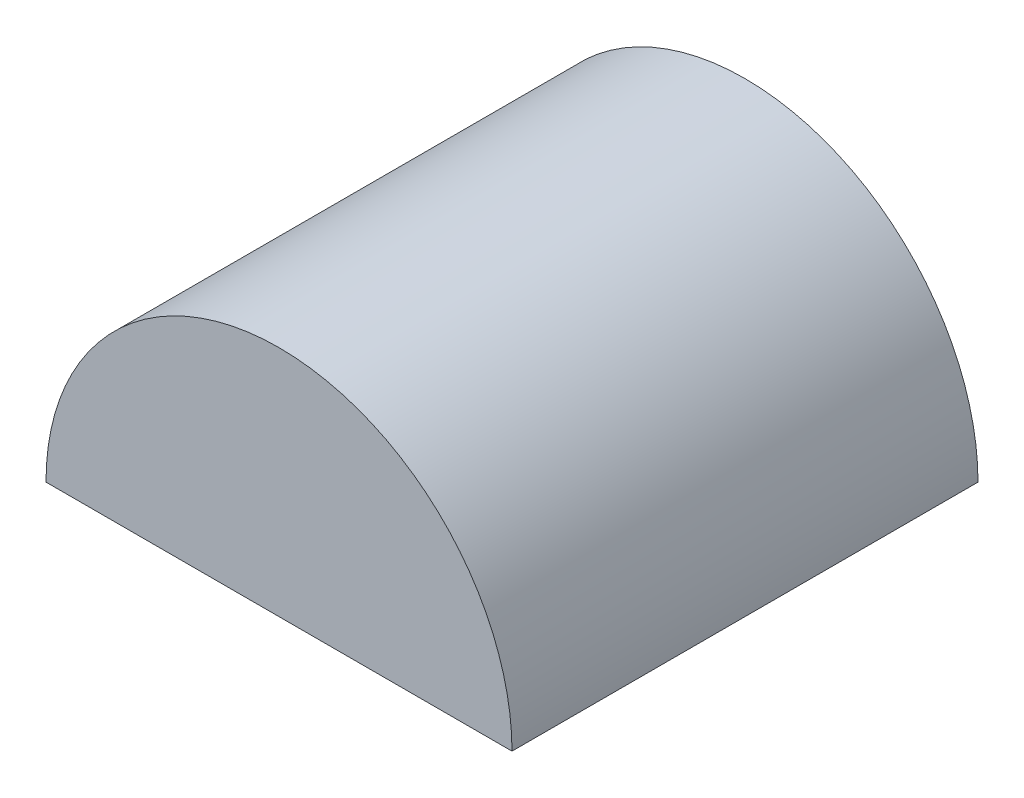
from build123d import *

# Parameters (mm, degrees)
BOSS_EXTRUDE1_DEPTH = 0.5


with BuildPart() as part:
    # Sketch1 → Boss-Extrude1 (new body)
    with BuildSketch(Plane.XY):
        with BuildLine():
            Line((0, 0), (-0.25, 0))
            ThreePointArc((-0.25, 0), (0, 0.25), (0.25, 0))
            Line((0.25, 0), (0, 0))
        make_face()
    extrude(amount=BOSS_EXTRUDE1_DEPTH)


solid = part.part
